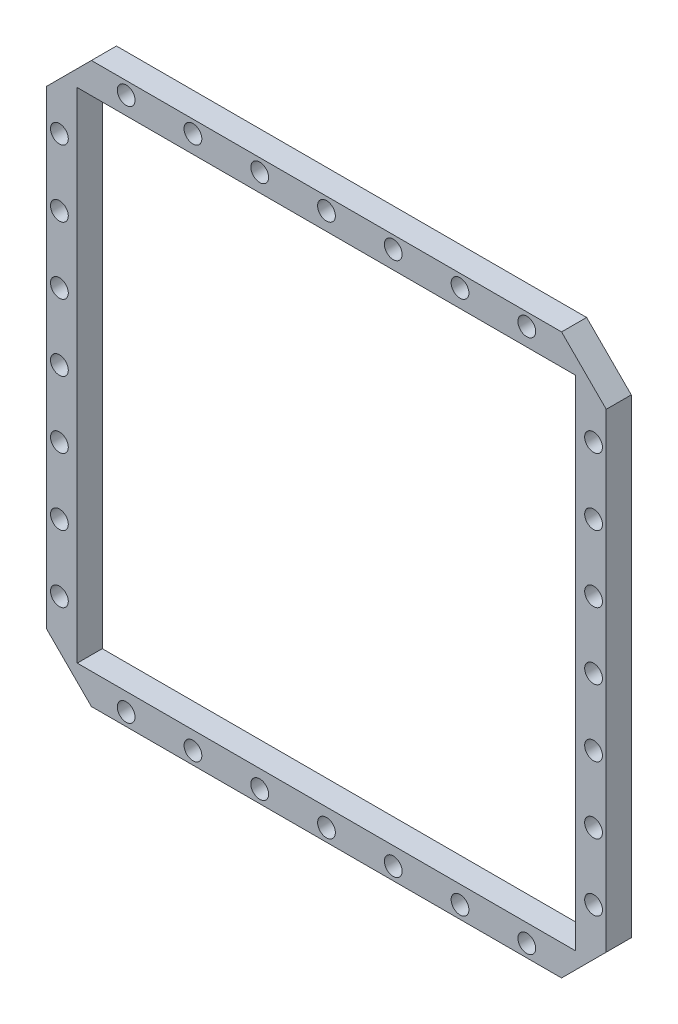
from build123d import *

# Parameters (mm, degrees)
SKETCH1_R           = 3.38
SKETCH1_W           = 189.625170906
SKETCH1_H           = 189.625170906
BOSS_EXTRUDE1_DEPTH = 9.525


with BuildPart() as part:
    # Sketch1 → Boss-Extrude1 (new body)
    with BuildSketch(Plane.XY):
        Polygon((16.997849507, 0), (0, -16.997849507), (0, -195.854150493), (16.997849507, -212.852), (195.854150493, -212.852), (212.852, -195.854150493), (212.852, -16.997849507), (195.854150493, 0), align=None)
        with Locations(Location((30.226, -208.026, 0), (0, 0, 180))):
            Circle(SKETCH1_R, mode=Mode.SUBTRACT)
        with Locations(Location((4.826, -182.626, 0), (0, 0, 180))):
            Circle(SKETCH1_R, mode=Mode.SUBTRACT)
        with Locations(Location((55.626, -208.026, 0), (0, 0, 180))):
            Circle(SKETCH1_R, mode=Mode.SUBTRACT)
        with Locations(Location((81.026, -208.026, 0), (0, 0, 180))):
            Circle(SKETCH1_R, mode=Mode.SUBTRACT)
        with Locations(Location((4.826, -157.226, 0), (0, 0, 180))):
            Circle(SKETCH1_R, mode=Mode.SUBTRACT)
        with Locations(Location((4.826, -131.826, 0), (0, 0, 180))):
            Circle(SKETCH1_R, mode=Mode.SUBTRACT)
        with Locations(Location((4.826, -106.426, 0), (0, 0, 180))):
            Circle(SKETCH1_R, mode=Mode.SUBTRACT)
        with Locations(Location((106.426, -208.026, 0), (0, 0, 180))):
            Circle(SKETCH1_R, mode=Mode.SUBTRACT)
        with Locations(Location((131.826, -208.026, 0), (0, 0, 180))):
            Circle(SKETCH1_R, mode=Mode.SUBTRACT)
        with Locations(Location((157.226, -208.026, 0), (0, 0, 180))):
            Circle(SKETCH1_R, mode=Mode.SUBTRACT)
        with Locations(Location((182.626, -208.026, 0), (0, 0, 180))):
            Circle(SKETCH1_R, mode=Mode.SUBTRACT)
        with Locations(Location((208.026, -182.626, 0), (0, 0, 180))):
            Circle(SKETCH1_R, mode=Mode.SUBTRACT)
        with Locations(Location((208.026, -157.226, 0), (0, 0, 180))):
            Circle(SKETCH1_R, mode=Mode.SUBTRACT)
        with Locations(Location((208.026, -131.826, 0), (0, 0, 180))):
            Circle(SKETCH1_R, mode=Mode.SUBTRACT)
        with Locations(Location((4.826, -81.026, 0), (0, 0, 180))):
            Circle(SKETCH1_R, mode=Mode.SUBTRACT)
        with Locations(Location((4.826, -55.626, 0), (0, 0, 180))):
            Circle(SKETCH1_R, mode=Mode.SUBTRACT)
        with Locations(Location((4.826, -30.226, 0), (0, 0, 180))):
            Circle(SKETCH1_R, mode=Mode.SUBTRACT)
        with Locations(Location((30.226, -4.826, 0), (0, 0, 180))):
            Circle(SKETCH1_R, mode=Mode.SUBTRACT)
        with Locations(Location((55.626, -4.826, 0), (0, 0, 180))):
            Circle(SKETCH1_R, mode=Mode.SUBTRACT)
        with Locations(Location((81.026, -4.826, 0), (0, 0, 180))):
            Circle(SKETCH1_R, mode=Mode.SUBTRACT)
        with Locations((106.426, -106.426)):
            Rectangle(SKETCH1_W, SKETCH1_H, mode=Mode.SUBTRACT)
        with Locations(Location((208.026, -106.426, 0), (0, 0, 180))):
            Circle(SKETCH1_R, mode=Mode.SUBTRACT)
        with Locations(Location((208.026, -81.026, 0), (0, 0, 180))):
            Circle(SKETCH1_R, mode=Mode.SUBTRACT)
        with Locations(Location((208.026, -55.626, 0), (0, 0, 180))):
            Circle(SKETCH1_R, mode=Mode.SUBTRACT)
        with Locations(Location((106.426, -4.826, 0), (0, 0, 180))):
            Circle(SKETCH1_R, mode=Mode.SUBTRACT)
        with Locations(Location((131.826, -4.826, 0), (0, 0, 180))):
            Circle(SKETCH1_R, mode=Mode.SUBTRACT)
        with Locations(Location((157.226, -4.826, 0), (0, 0, 180))):
            Circle(SKETCH1_R, mode=Mode.SUBTRACT)
        with Locations(Location((208.026, -30.226, 0), (0, 0, 180))):
            Circle(SKETCH1_R, mode=Mode.SUBTRACT)
        with Locations(Location((182.626, -4.826, 0), (0, 0, 180))):
            Circle(SKETCH1_R, mode=Mode.SUBTRACT)
    extrude(amount=BOSS_EXTRUDE1_DEPTH)


solid = part.part
